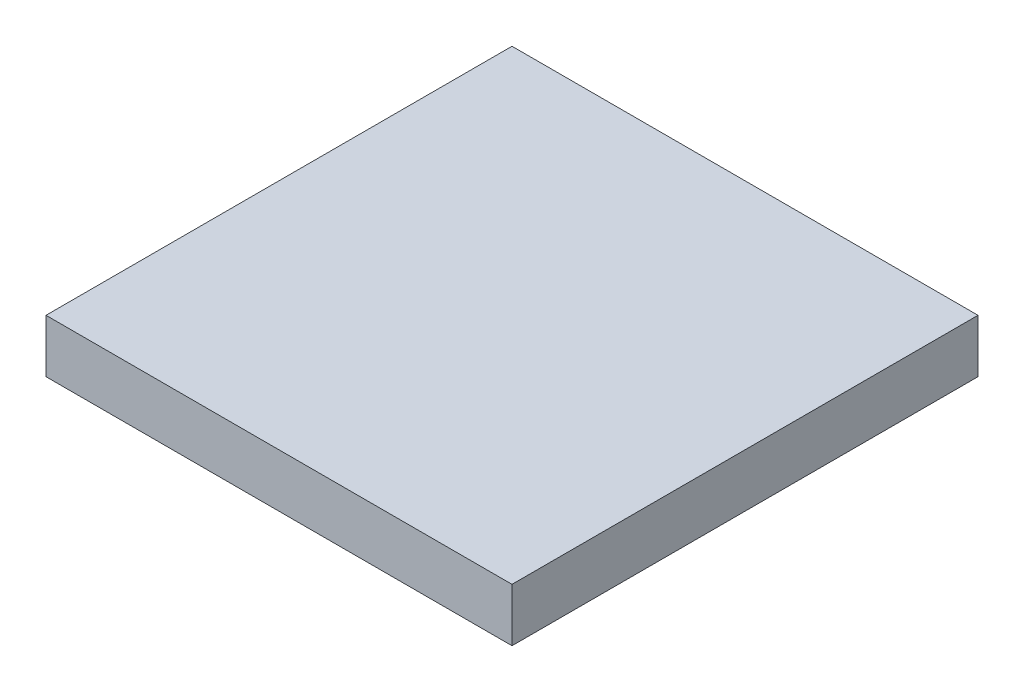
from build123d import *

# Parameters (mm, degrees)
SKETCH1_W           = 44.5
SKETCH1_H           = 44.5
BOSS_EXTRUDE1_DEPTH = 5.08


with BuildPart() as part:
    # Sketch1 → Boss-Extrude1 (new body)
    with BuildSketch(Plane(origin=(0, 0, 0), x_dir=(1, 0, 0), z_dir=(0, 1, 0))):
        with Locations((22.25, 22.25)):
            Rectangle(SKETCH1_W, SKETCH1_H)
    extrude(amount=BOSS_EXTRUDE1_DEPTH)


solid = part.part
